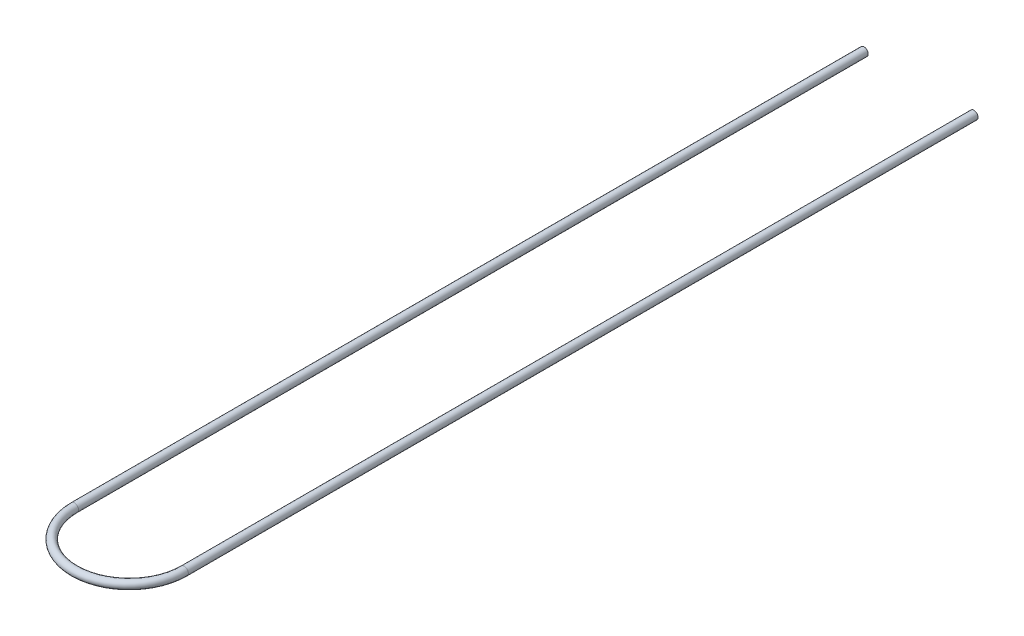
from build123d import *

# Parameters (mm, degrees)
SKETCH2_R   = 11.1
SKETCH2_R_2 = 9.95


with BuildPart() as part:
    # Sweep1: sweep along a path in Sketch1
    with BuildLine(Plane(origin=(0, 0, 0), x_dir=(1, 0, 0), z_dir=(0, 1, 0))) as sweep1_path:
        Line((257.54, -300), (257.54, -2440))
        ThreePointArc((257.54, -2440), (108.77, -2588.77), (-40, -2440))
        Line((-40, -2440), (-40, -300))
    # Sketch2 → Sweep1 (sweep)
    with BuildSketch(Plane(origin=(257.54, 0, 300), x_dir=(-1, 0, 0), z_dir=(0, 0, -1))):
        Circle(SKETCH2_R)
        Circle(SKETCH2_R_2, mode=Mode.SUBTRACT)
    sweep(path=sweep1_path.line)


solid = part.part
